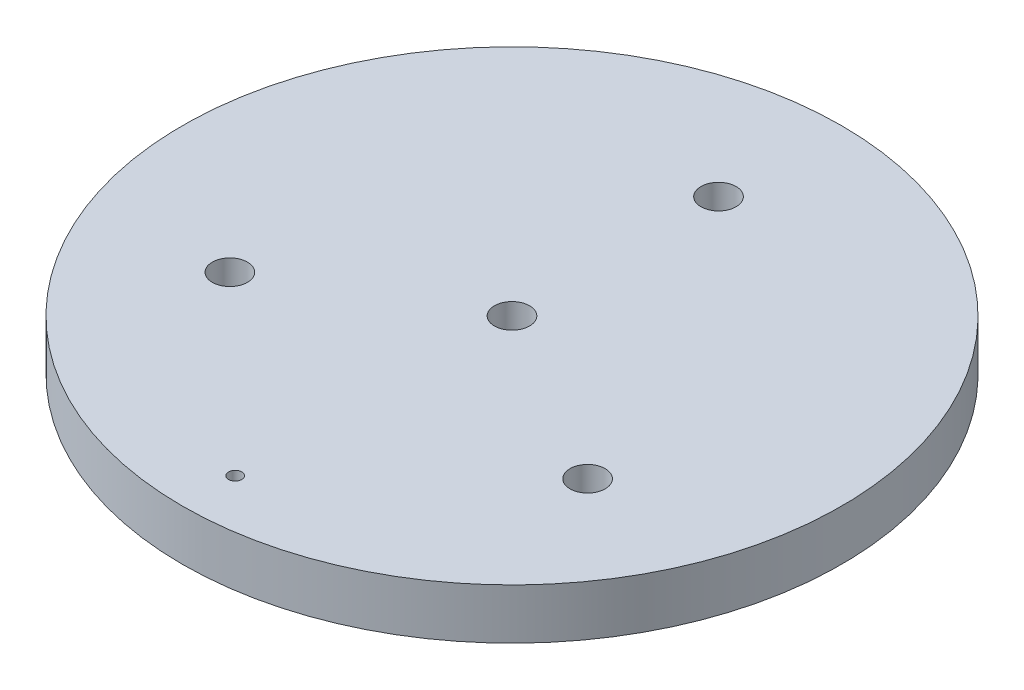
from build123d import *

# Parameters (mm, degrees)
SKETCH1_R           = 75
BOSS_EXTRUDE1_DEPTH = 11.482
SKETCH2_R           = 4
CUT_EXTRUDE1_DEPTH  = 107.685689406
CIRPATTERN1_COUNT   = 3
SKETCH3_R           = 1.5
CUT_EXTRUDE2_DEPTH  = 107.685689406
SKETCH4_R           = 4
CUT_EXTRUDE3_DEPTH  = 107.685689406


with BuildPart() as part:
    # Sketch1 → Boss-Extrude1 (new body)
    with BuildSketch(Plane(origin=(0, 0, 0), x_dir=(1, 0, 0), z_dir=(0, 1, 0))):
        Circle(SKETCH1_R)
    extrude(amount=BOSS_EXTRUDE1_DEPTH)

    # Sketch2 → Cut-Extrude1 (cut, through all)
    with BuildSketch(Plane(origin=(0, 11.482, 0), x_dir=(1, 0, 0), z_dir=(0, 1, 0))):
        with Locations((0, 47)):
            Circle(SKETCH2_R)
    cut_extrude1 = extrude(amount=-CUT_EXTRUDE1_DEPTH, mode=Mode.SUBTRACT)

    # CirPattern1: Cut-Extrude1 ×3 about axis
    cirpattern1_axis = Axis((0, 33.6, 0), (0, -1, 0))
    for i in range(1, CIRPATTERN1_COUNT):
        add(cut_extrude1.rotate(cirpattern1_axis, i * 360 / CIRPATTERN1_COUNT), mode=Mode.SUBTRACT)

    # Sketch3 → Cut-Extrude2 (cut, through all)
    with BuildSketch(Plane(origin=(0, 11.482, 0), x_dir=(1, 0, 0), z_dir=(0, 1, 0))):
        with Locations((0, -63)):
            Circle(SKETCH3_R)
    extrude(amount=-CUT_EXTRUDE2_DEPTH, mode=Mode.SUBTRACT)

    # Sketch4 → Cut-Extrude3 (cut, through all)
    with BuildSketch(Plane(origin=(0, 11.482, 0), x_dir=(1, 0, 0), z_dir=(0, 1, 0))):
        Circle(SKETCH4_R)
    extrude(amount=-CUT_EXTRUDE3_DEPTH, mode=Mode.SUBTRACT)


solid = part.part
